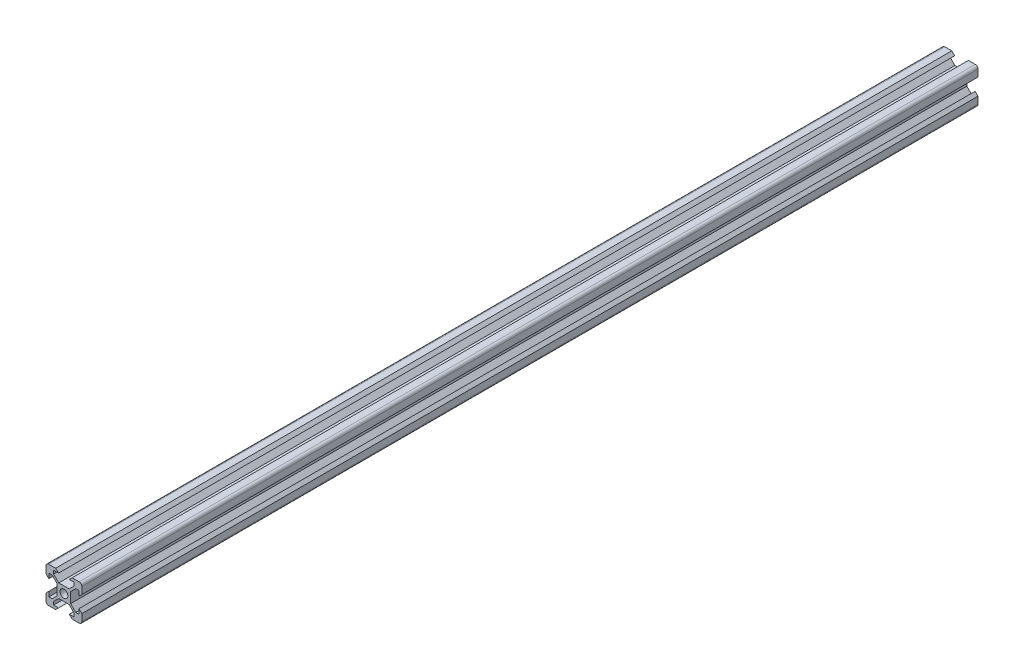
from build123d import *

# Parameters (mm, degrees)
SKETCH1_W           = 15.088
SKETCH1_H           = 15.088
SKETCH1_R           = 4.4
BOSS_EXTRUDE1_DEPTH = 500


with BuildPart() as part:
    # Sketch1 → Boss-Extrude1 (new, symmetric)
    # profile 1 of 5: a face of its own
    with BuildSketch(Plane.XY):
        with BuildLine():
            Line((-7.544, 7.544), (-5.784718328, 7.544))
            Line((-5.784718328, 7.544), (-11.512, 13.271281672))
            Line((-11.512, 13.271281672), (-11.512, 16.8))
            Line((-11.512, 16.8), (-6.051976926, 16.8))
            Line((-6.051976926, 16.8), (-9.251976926, 20))
            Line((-9.251976926, 20), (-17, 20))
            ThreePointArc((-17, 20), (-19.121320344, 19.121320344), (-20, 17))
            Line((-20, 17), (-20, 9.251976926))
            Line((-20, 9.251976926), (-16.8, 6.051976926))
            Line((-16.8, 6.051976926), (-16.8, 11.512))
            Line((-16.8, 11.512), (-13.271281672, 11.512))
            Line((-13.271281672, 11.512), (-7.544, 5.784718328))
            Line((-7.544, 5.784718328), (-7.544, 7.544))
        make_face()
    # profile 2 of 5: a face of its own
    with BuildSketch(Plane.XY):
        with BuildLine():
            Line((11.512, 13.271281672), (5.784718328, 7.544))
            Line((5.784718328, 7.544), (7.544, 7.544))
            Line((7.544, 7.544), (7.544, 5.784718328))
            Line((7.544, 5.784718328), (13.271281672, 11.512))
            Line((13.271281672, 11.512), (16.8, 11.512))
            Line((16.8, 11.512), (16.8, 6.051976926))
            Line((16.8, 6.051976926), (20, 9.251976926))
            Line((20, 9.251976926), (20, 17))
            ThreePointArc((20, 17), (19.121320344, 19.121320344), (17, 20))
            Line((17, 20), (9.251976926, 20))
            Line((9.251976926, 20), (6.051976926, 16.8))
            Line((6.051976926, 16.8), (11.512, 16.8))
            Line((11.512, 16.8), (11.512, 13.271281672))
        make_face()
    # profile 3 of 5: a face of its own
    with BuildSketch(Plane.XY):
        with BuildLine():
            Line((-7.544, -7.544), (-7.544, -5.784718328))
            Line((-7.544, -5.784718328), (-13.271281672, -11.512))
            Line((-13.271281672, -11.512), (-16.8, -11.512))
            Line((-16.8, -11.512), (-16.8, -6.051976926))
            Line((-16.8, -6.051976926), (-20, -9.251976926))
            Line((-20, -9.251976926), (-20, -17))
            ThreePointArc((-20, -17), (-19.121320344, -19.121320344), (-17, -20))
            Line((-17, -20), (-9.251976926, -20))
            Line((-9.251976926, -20), (-6.051976926, -16.8))
            Line((-6.051976926, -16.8), (-11.512, -16.8))
            Line((-11.512, -16.8), (-11.512, -13.271281672))
            Line((-11.512, -13.271281672), (-5.784718328, -7.544))
            Line((-5.784718328, -7.544), (-7.544, -7.544))
        make_face()
    # profile 4 of 5: a face of its own
    with BuildSketch(Plane.XY):
        with BuildLine():
            Line((13.271281672, -11.512), (7.544, -5.784718328))
            Line((7.544, -5.784718328), (7.544, -7.544))
            Line((7.544, -7.544), (5.784718328, -7.544))
            Line((5.784718328, -7.544), (11.512, -13.271281672))
            Line((11.512, -13.271281672), (11.512, -16.8))
            Line((11.512, -16.8), (6.051976926, -16.8))
            Line((6.051976926, -16.8), (9.251976926, -20))
            Line((9.251976926, -20), (17, -20))
            ThreePointArc((17, -20), (19.121320344, -19.121320344), (20, -17))
            Line((20, -17), (20, -9.251976926))
            Line((20, -9.251976926), (16.8, -6.051976926))
            Line((16.8, -6.051976926), (16.8, -11.512))
            Line((16.8, -11.512), (13.271281672, -11.512))
        make_face()
    # profile 5 of 5: a face of its own
    with BuildSketch(Plane.XY):
        Rectangle(SKETCH1_W, SKETCH1_H)
        Circle(SKETCH1_R, mode=Mode.SUBTRACT)
    extrude(amount=BOSS_EXTRUDE1_DEPTH, both=True)


solid = part.part
